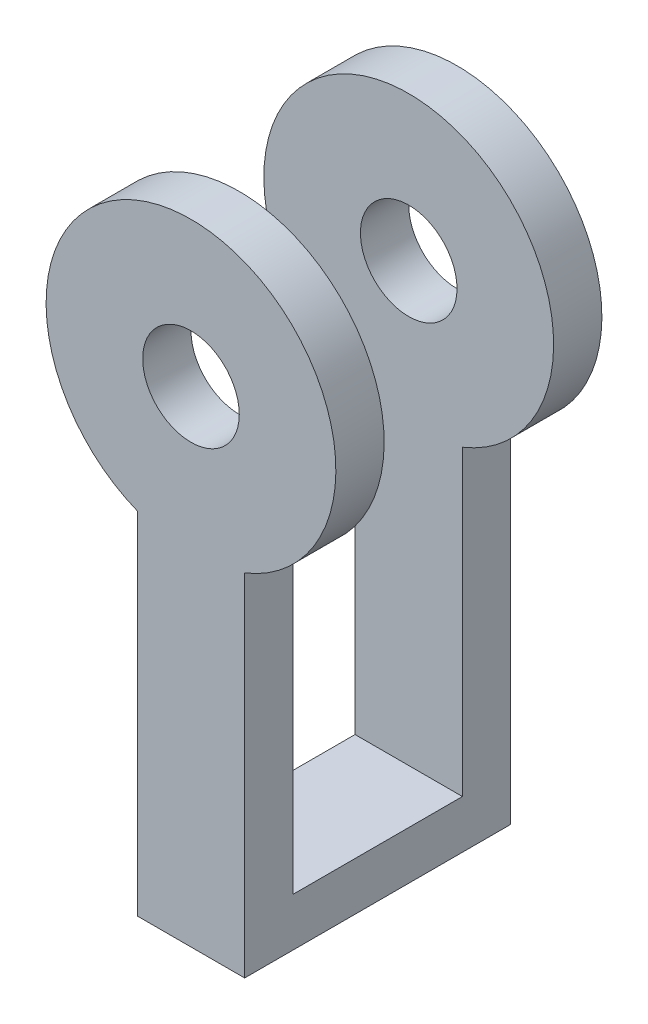
from build123d import *

# Parameters (mm, degrees)
EXTRUDE_5_DEPTH      = 30
EXTRUDE_5_DEPTH_BACK = 30
F_1_FR_R             = 5
EXTRUDE_6_DEPTH      = 20
EXTRUDE_6_DEPTH_BACK = 20


with BuildPart() as part:
    # Эскиз1_fr → Бобышка-Вытянуть5 (new, two sides: drawn at the far end of the back side and taken through both)
    with BuildSketch(Plane.XY.offset(-EXTRUDE_5_DEPTH_BACK)):
        with BuildLine():
            Line((-5.557606452, -13.932444528), (-5.557606452, -62.642280008))
            Line((-5.557606452, -62.642280008), (5.557606452, -62.642280008))
            Line((5.557606452, -62.642280008), (5.557606452, -13.932444528))
            ThreePointArc((5.557606452, -13.932444528), (0, 15), (-5.557606452, -13.932444528))
        make_face()
        Circle(F_1_FR_R, mode=Mode.SUBTRACT)
    extrude(amount=EXTRUDE_5_DEPTH + EXTRUDE_5_DEPTH_BACK)


with BuildPart() as body_2:
    # Эскиз3 → Бобышка-Вытянуть6 (new, two sides: drawn at the far end of the back side and taken through both)
    with BuildSketch(Plane(origin=(0, 0, 0), x_dir=(0, 0, -1), z_dir=(1, 0, 0)).offset(-EXTRUDE_6_DEPTH_BACK)):
        Polygon((-58.394498043, -50.25314581), (-85.938130262, -50.25314581), (-85.938130262, 27.580465306), (-80.938130262, 27.580465306), (-80.938130262, -45.25314581), (-63.394498043, -45.25314581), (-63.394498043, 27.580465306), (-58.394498043, 27.580465306), align=None)
    extrude(amount=EXTRUDE_6_DEPTH + EXTRUDE_6_DEPTH_BACK)


with BuildPart() as body_2_1:
    # Move Body 1: moved
    add(body_2.part.moved(Location((0, 0, -70))))


with BuildPart() as part_1:
    add(part.part)

    # Combine 1: intersect body 2
    add(body_2_1.part, mode=Mode.INTERSECT)


solid = part_1.part
